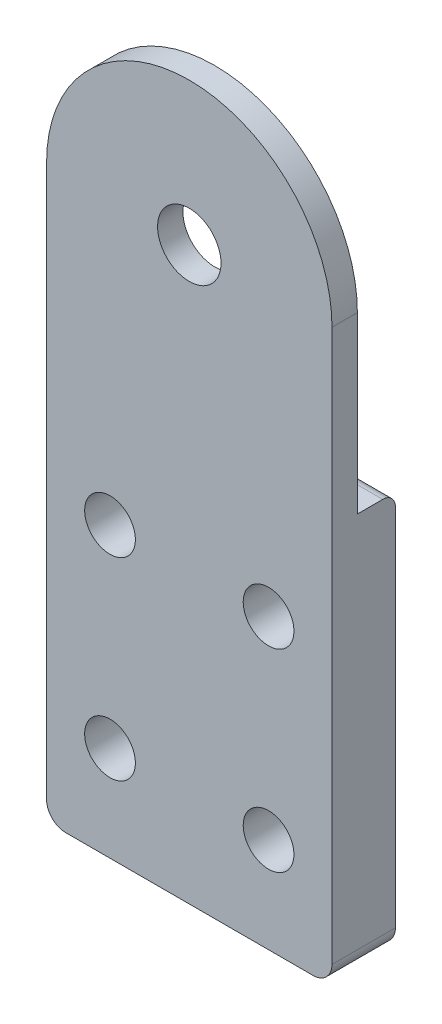
from build123d import *

# Parameters (mm, degrees)
EXTRUDE_1_DEPTH     = 10
CUT_EXTRUDE_1_DEPTH = 6
FILLET_1_R          = 2
SKETCH_3_R          = 5
CUT_EXTRUDE_2_DEPTH = 6
SKETCH_5_R          = 4
CUT_EXTRUDE_3_DEPTH = 94.307288033


with BuildPart() as part:
    # 草图1 → 凸台-拉伸1 (new body)
    with BuildSketch(Plane.XY):
        with BuildLine():
            Line((-22.5, 0), (-22.5, -87))
            ThreePointArc((-22.5, -87), (-21.621320344, -89.121320344), (-19.5, -90))
            Line((-19.5, -90), (19.5, -90))
            ThreePointArc((19.5, -90), (21.621320344, -89.121320344), (22.5, -87))
            Line((22.5, -87), (22.5, 0))
            ThreePointArc((22.5, 0), (0, 22.5), (-22.5, 0))
        make_face()
    extrude(amount=EXTRUDE_1_DEPTH)

    # 草图2 → 切除-拉伸1 (cut)
    with BuildSketch(Plane(origin=(0, 0, 0), x_dir=(-1, 0, 0), z_dir=(0, 0, -1))):
        with BuildLine():
            Line((-22.5, 0), (-22.5, -27.5))
            Line((-22.5, -27.5), (22.5, -27.5))
            Line((22.5, -27.5), (22.5, 0))
            ThreePointArc((22.5, 0), (15.909902614, 15.909902539), (1.06e-07, 22.5))
            ThreePointArc((1.06e-07, 22.5), (-15.909902539, 15.909902614), (-22.5, 0))
        make_face()
    extrude(amount=-CUT_EXTRUDE_1_DEPTH, mode=Mode.SUBTRACT)

    # 圆角1
    fillet_1_edges = [part.edges().sort_by_distance(p)[0] for p in [
        (0, -27.5, 0),
    ]]
    fillet(fillet_1_edges, radius=FILLET_1_R)

    # 草图3 → 切除-拉伸2 (cut)
    with BuildSketch(Plane.XY.offset(10)):
        Circle(SKETCH_3_R)
    extrude(amount=-CUT_EXTRUDE_2_DEPTH, mode=Mode.SUBTRACT)

    # 草图5 → 切除-拉伸3 (cut, through all)
    with BuildSketch(Plane(origin=(0, 0, 0), x_dir=(-1, 0, 0), z_dir=(0, 0, -1))):
        with Locations((-12.5, -44.5)):
            Circle(SKETCH_5_R)
        with Locations((12.5, -44.5)):
            Circle(SKETCH_5_R)
        with Locations((12.5, -75)):
            Circle(SKETCH_5_R)
        with Locations((-12.5, -75)):
            Circle(SKETCH_5_R)
    extrude(amount=-CUT_EXTRUDE_3_DEPTH, mode=Mode.SUBTRACT)


solid = part.part
